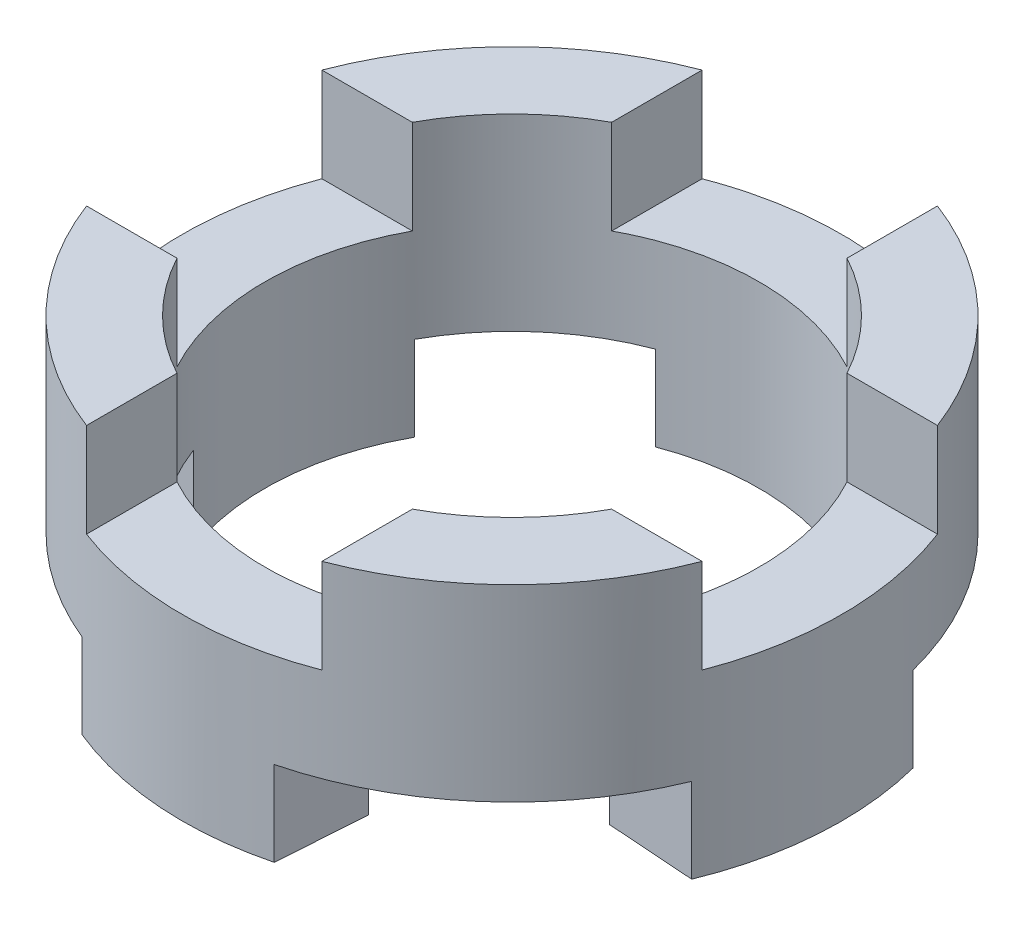
from build123d import *
from build123d.topology import SkipClean

# Parameters (mm, degrees)
SKETCH_1_R          = 7
SKETCH_1_R_2        = 5.25
EXTRUDE_1_DEPTH     = 4
CUT_EXTRUDE_1_DEPTH = 2
EXTRUDE_START       = 1.8
EXTRUDE_2_DEPTH     = 1.8


with BuildPart() as part:
    # 草图1 → 凸台-拉伸1 (new body)
    with BuildSketch(Plane(origin=(0, 0, 0), x_dir=(1, 0, 0), z_dir=(0, 1, 0))):
        with Locations(Location((0, 0, 0), (0, 0, 270))):
            Circle(SKETCH_1_R)
        with Locations(Location((0, 0, 0), (0, 0, 270))):
            Circle(SKETCH_1_R_2, mode=Mode.SUBTRACT)
    extrude(amount=EXTRUDE_1_DEPTH)

    # 草图2 → 切除-拉伸1 (cut)
    with BuildSketch(Plane(origin=(0, 4, 0), x_dir=(1, 0, 0), z_dir=(0, 1, 0))):
        Polygon((-2.5, 2.5), (-2.5, 8), (2.5, 8), (2.5, 2.5), (8, 2.5), (8, -2.5), (2.5, -2.5), (2.5, -8), (-2.5, -8), (-2.5, -2.5), (-8, -2.5), (-8, 2.5), align=None)
    extrude(amount=-CUT_EXTRUDE_1_DEPTH, mode=Mode.SUBTRACT)

    # 草图3 → 凸台-拉伸2 (add)
    with SkipClean():  # the faces are left unmerged after this step: merging them gives an invalid solid
        with BuildSketch(Plane.XZ.offset(EXTRUDE_START)):
            with BuildLine():
                ThreePointArc((1.731088279, 6.782575718), (-0.488295316, 6.982948352), (-2.658193542, 6.475647234))
                Line((-2.658193542, 6.475647234), (-2.527156931, 4.601736395))
                ThreePointArc((-2.527156931, 4.601736395), (-0.366221487, 5.237211264), (1.86212489, 4.908664879))
                Line((1.86212489, 4.908664879), (1.731088279, 6.782575718))
            make_face()
            with BuildLine():
                Line((-4.908664879, 1.86212489), (-6.782575718, 1.731088279))
                ThreePointArc((-6.782575718, 1.731088279), (-6.982948352, -0.488295316), (-6.475647234, -2.658193542))
                Line((-6.475647234, -2.658193542), (-4.601736395, -2.527156931))
                ThreePointArc((-4.601736395, -2.527156931), (-5.237211264, -0.366221487), (-4.908664879, 1.86212489))
            make_face()
            with BuildLine():
                Line((-1.86212489, -4.908664879), (-1.731088279, -6.782575718))
                ThreePointArc((-1.731088279, -6.782575718), (0.488295316, -6.982948352), (2.658193542, -6.475647234))
                Line((2.658193542, -6.475647234), (2.527156931, -4.601736395))
                ThreePointArc((2.527156931, -4.601736395), (0.366221487, -5.237211264), (-1.86212489, -4.908664879))
            make_face()
            with BuildLine():
                ThreePointArc((7, 0), (6.867660833, 1.354708339), (6.475647234, 2.658193542))
                Line((6.475647234, 2.658193542), (4.601736395, 2.527156931))
                ThreePointArc((4.601736395, 2.527156931), (5.085352302, 1.304489158), (5.25, 0))
                ThreePointArc((5.25, 0), (5.163961203, -0.946575244), (4.908664879, -1.86212489))
                Line((4.908664879, -1.86212489), (6.782575718, -1.731088279))
                ThreePointArc((6.782575718, -1.731088279), (6.945431233, -0.872344535), (7, 0))
            make_face()
        extrude(amount=-EXTRUDE_2_DEPTH)


solid = part.part
